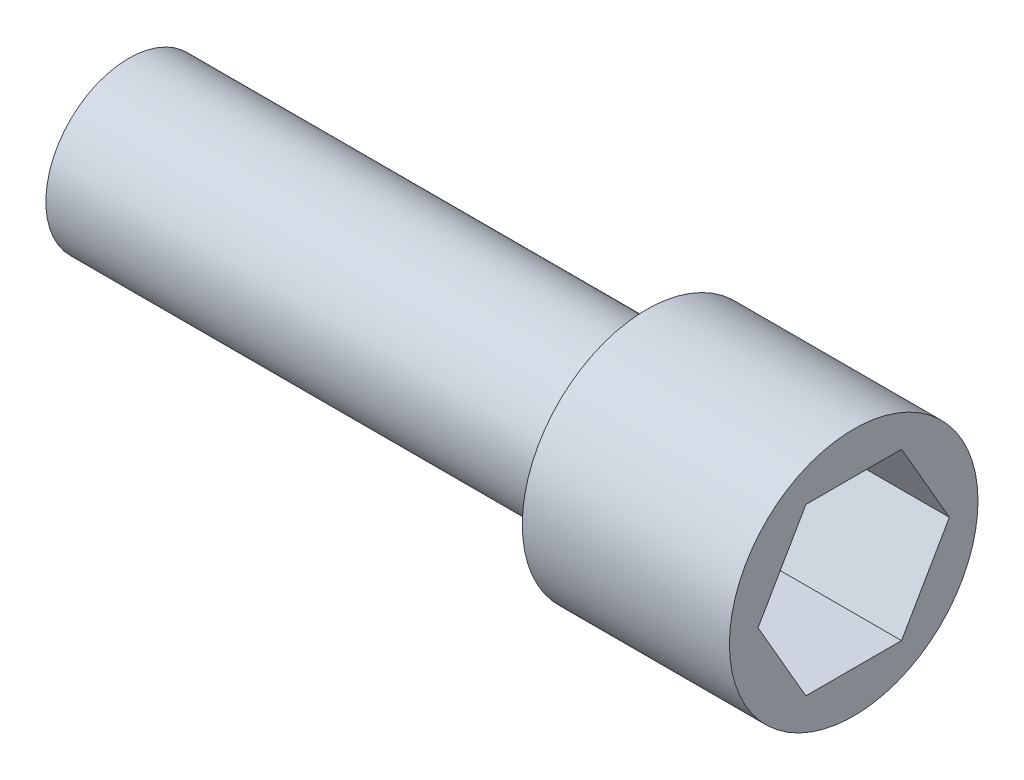
from build123d import *

# Parameters (mm, degrees)
CUT_EXTRUDE1_DEPTH = 7


with BuildPart() as part:
    # Sketch1 → Revolve1 (revolve)
    with BuildSketch(Plane.XY, mode=Mode.PRIVATE) as revolve1_sk:
        Polygon((0, 0), (0, 4), (25, 4), (25, 6), (35, 6), (35, 0), align=None)
    revolve(revolve1_sk.sketch.rotate(Axis((35, 0, 0), (-1, 0, 0)), 90), axis=Axis((35, 0, 0), (-1, 0, 0)))

    # Sketch2 → Cut-Extrude1 (cut)
    with BuildSketch(Plane(origin=(35, 0, 0), x_dir=(0, 0, -1), z_dir=(1, 0, 0))):
        Polygon((4.618802154, 0), (2.309401077, 4), (-2.309401077, 4), (-4.618802154, 0), (-2.309401077, -4), (2.309401077, -4), align=None)
    extrude(amount=-CUT_EXTRUDE1_DEPTH, mode=Mode.SUBTRACT)


solid = part.part
